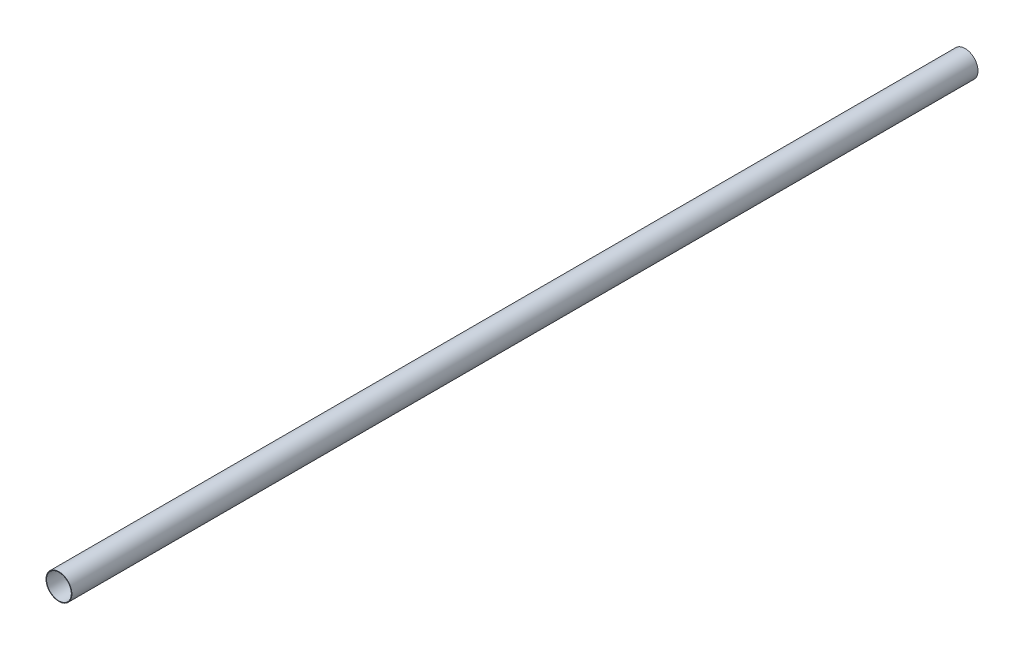
from build123d import *

# Parameters (mm, degrees)
SKETCH1_R           = 15
SKETCH1_R_2         = 14.35
BOSS_EXTRUDE1_DEPTH = 1050


with BuildPart() as part:
    # Sketch1 → Boss-Extrude1 (new body)
    with BuildSketch(Plane.XY):
        Circle(SKETCH1_R)
        Circle(SKETCH1_R_2, mode=Mode.SUBTRACT)
    extrude(amount=BOSS_EXTRUDE1_DEPTH)


solid = part.part
